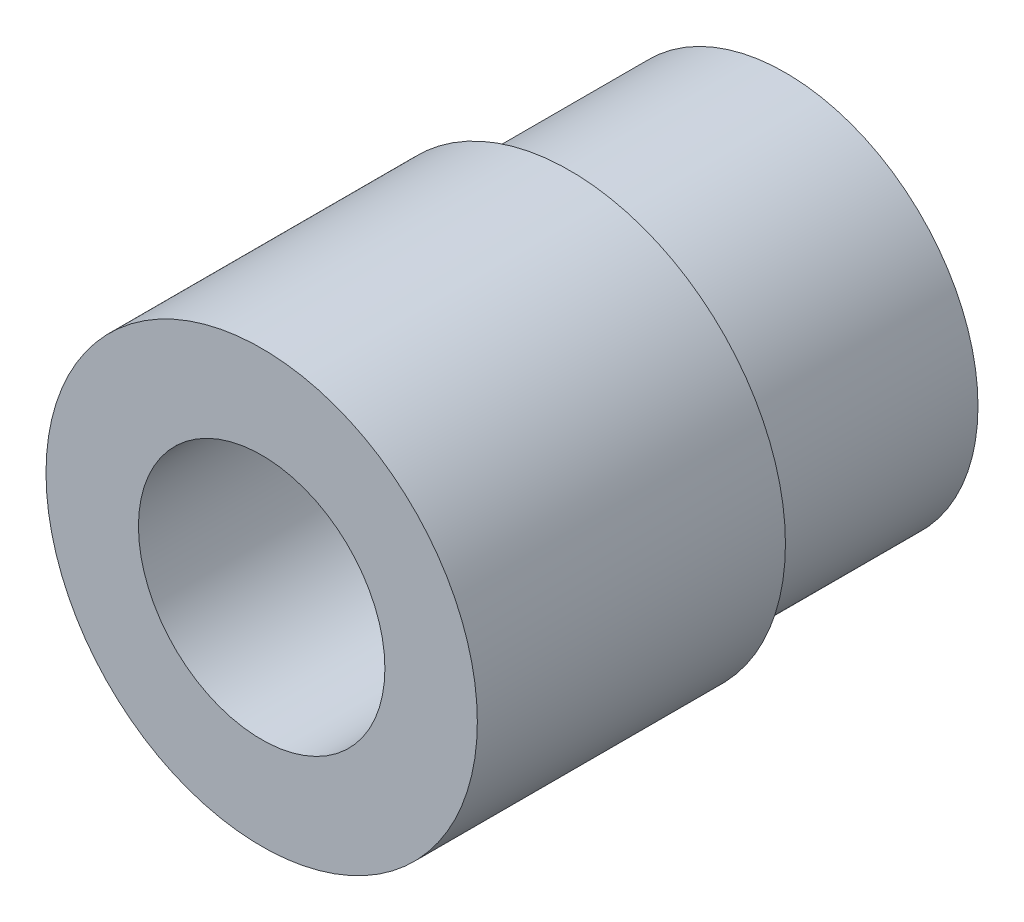
from build123d import *

# Parameters (mm, degrees)
SKETCH1_R      = 12.5
SMALLO_D_DEPTH = 14
SKETCH2_R      = 14
LARGEO_D_DEPTH = 20
SKETCH3_R      = 8
BORE_DEPTH     = 40.344631146


with BuildPart() as part:
    # Sketch1 → SmallO.D. (new body)
    with BuildSketch(Plane.XY):
        Circle(SKETCH1_R)
    extrude(amount=SMALLO_D_DEPTH)

    # Sketch2 → LargeO.D. (add)
    with BuildSketch(Plane.XY.offset(14)):
        Circle(SKETCH2_R)
    extrude(amount=LARGEO_D_DEPTH)

    # Sketch3 → Bore (cut, through all)
    with BuildSketch(Plane.XY.offset(34)):
        Circle(SKETCH3_R)
    extrude(amount=-BORE_DEPTH, mode=Mode.SUBTRACT)


solid = part.part
